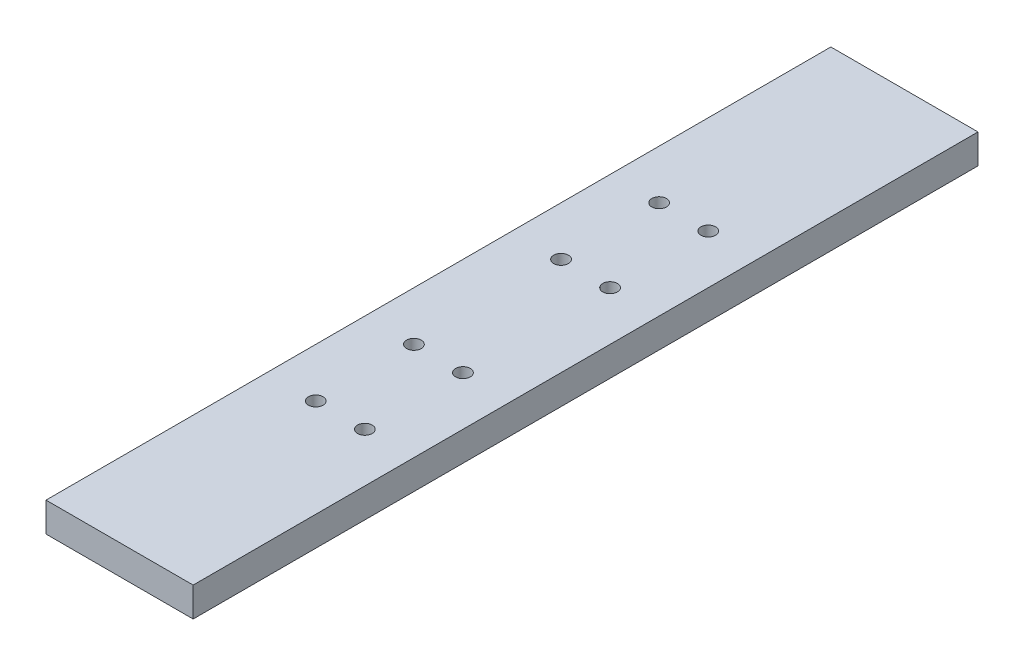
from build123d import *

# Parameters (mm, degrees)
SKETCH2_W           = 30
SKETCH2_H           = 6
BOSS_EXTRUDE1_DEPTH = 160
SKETCH3_R           = 1.5
CUT_EXTRUDE3_DEPTH  = 161.813556642


with BuildPart() as part:
    # Sketch2 → Boss-Extrude1 (new body)
    with BuildSketch(Plane.XY):
        Rectangle(SKETCH2_W, SKETCH2_H)
    extrude(amount=BOSS_EXTRUDE1_DEPTH)

    # Sketch3 → Cut-Extrude3 (cut, through all)
    with BuildSketch(Plane(origin=(0, 3, 0), x_dir=(1, 0, 0), z_dir=(0, 1, 0))):
        with Locations(Location((-5, -115, 0), (0, 0, 270))):
            Circle(SKETCH3_R)
        with Locations(Location((5, -115, 0), (0, 0, 270))):
            Circle(SKETCH3_R)
        with Locations(Location((5, -95, 0), (0, 0, 270))):
            Circle(SKETCH3_R)
        with Locations(Location((-5, -95, 0), (0, 0, 270))):
            Circle(SKETCH3_R)
        with Locations(Location((-5, -65, 0), (0, 0, 90))):
            Circle(SKETCH3_R)
        with Locations(Location((5, -65, 0), (0, 0, 90))):
            Circle(SKETCH3_R)
        with Locations(Location((5, -45, 0), (0, 0, 90))):
            Circle(SKETCH3_R)
        with Locations(Location((-5, -45, 0), (0, 0, 90))):
            Circle(SKETCH3_R)
    extrude(amount=-CUT_EXTRUDE3_DEPTH, mode=Mode.SUBTRACT)


solid = part.part
